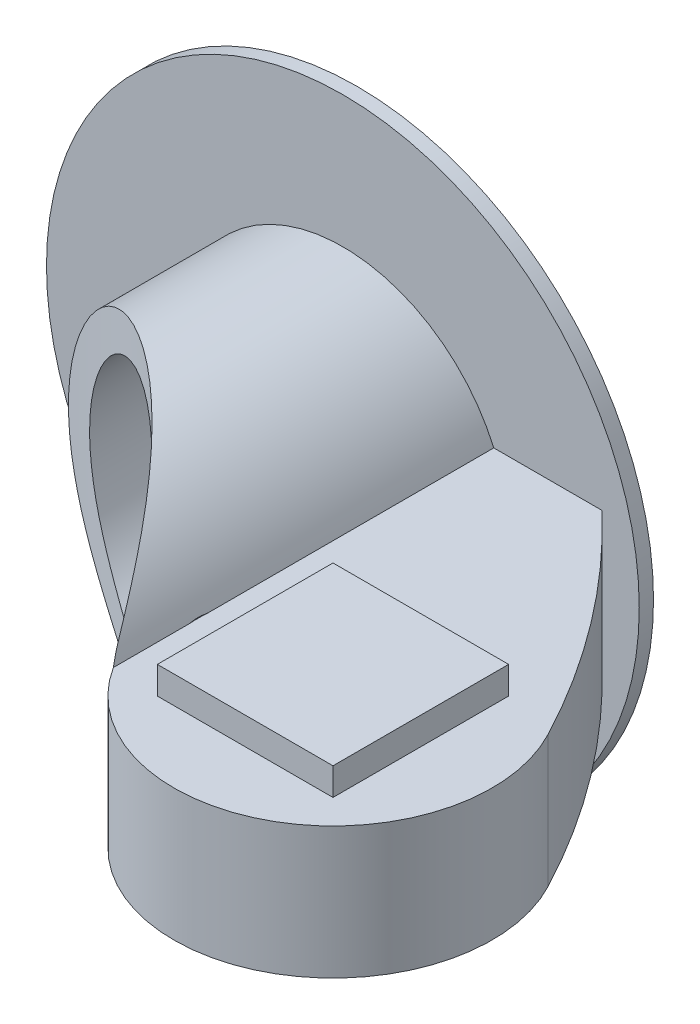
from build123d import *

# Parameters (mm, degrees)
SKETCH_1_R           = 270
EXTRUDE_1_DEPTH      = 13
SKETCH_2_R           = 150
SKETCH_2_R_2         = 120
EXTRUDE_2_DEPTH      = 400
CUT_EXTRUDE_1_DEPTH  = 220
EXTRUDE_3_DEPTH      = 60
SKETCH_27_W          = 165
SKETCH_27_H          = 165
EXTRUDE_14_DEPTH     = 30
SKETCH_51_R          = 122.82
CUT_EXTRUDE_20_DEPTH = 25
SKETCH_52_W          = 160
SKETCH_52_H          = 160
EXTRUDE_33_DEPTH     = 25
SKETCH_53_R          = 50
EXTRUDE_34_DEPTH     = 10


with BuildPart() as part:
    # 草图1 → 凸台-拉伸1 (new body)
    with BuildSketch(Plane.XY):
        with Locations(Location((0, 0, 0), (0, 0, 180))):
            Circle(SKETCH_1_R)
    extrude(amount=EXTRUDE_1_DEPTH)

    # 草图2 → 凸台-拉伸2 (add)
    with BuildSketch(Plane.XY):
        Circle(SKETCH_2_R)
        Circle(SKETCH_2_R_2, mode=Mode.SUBTRACT)
    extrude(amount=EXTRUDE_2_DEPTH)

    # 草图4 → 切除-拉伸1 (cut, symmetric)
    with BuildSketch(Plane(origin=(0, 0, 0), x_dir=(1, 0, 0), z_dir=(0, 1, 0))):
        with BuildLine():
            Line((-150, -113), (-150, -400))
            Line((-150, -400), (175.732568569, -400))
            ThreePointArc((175.732568569, -400), (150.72256284, -377.307091697), (131.640141985, -349.444398214))
            ThreePointArc((131.640141985, -349.444398214), (14.085885106, -203.509183955), (-150, -113))
        make_face()
    extrude(amount=CUT_EXTRUDE_1_DEPTH, both=True, mode=Mode.SUBTRACT)

    # 草图5 → 凸台-拉伸3 (add, symmetric)
    with BuildSketch(Plane(origin=(0, 0, 0), x_dir=(1, 0, 0), z_dir=(0, 1, 0))):
        with BuildLine():
            Line((131.640141985, -13), (235.929592589, -13))
            ThreePointArc((235.929592589, -13), (320.412645509, -107.525028653), (388.359858015, -214.555601786))
            ThreePointArc((388.359858015, -214.555601786), (327.444398214, -410.359858015), (131.640141985, -349.444398214))
            Line((131.640141985, -349.444398214), (131.640141985, -13))
        make_face()
    extrude(amount=EXTRUDE_3_DEPTH, both=True)

    # 草图27 → 凸台-拉伸14 (add)
    with BuildSketch(Plane.XY.offset(13)):
        Rectangle(SKETCH_27_W, SKETCH_27_H)
    extrude(amount=EXTRUDE_14_DEPTH)

    # 草图51 → 切除-拉伸20 (cut)
    with BuildSketch(Plane(origin=(0, 60, 0), x_dir=(1, 0, 0), z_dir=(0, 1, 0))):
        with Locations((260, -282)):
            Circle(SKETCH_51_R)
    extrude(amount=CUT_EXTRUDE_20_DEPTH, mode=Mode.SUBTRACT)

    # 草图52 → 凸台-拉伸33 (add)
    with BuildSketch(Plane(origin=(0, 60, 0), x_dir=(1, 0, 0), z_dir=(0, 1, 0))):
        with Locations((260, -282)):
            Rectangle(SKETCH_52_W, SKETCH_52_H)
    extrude(amount=EXTRUDE_33_DEPTH)

    # 草图53 → 凸台-拉伸34 (add)
    with BuildSketch(Plane(origin=(0, -60, 0), x_dir=(-1, 0, 0), z_dir=(0, -1, 0))):
        with Locations(Location((-260, -282, 0), (0, 0, 270))):
            Circle(SKETCH_53_R)
    extrude(amount=EXTRUDE_34_DEPTH)


solid = part.part
